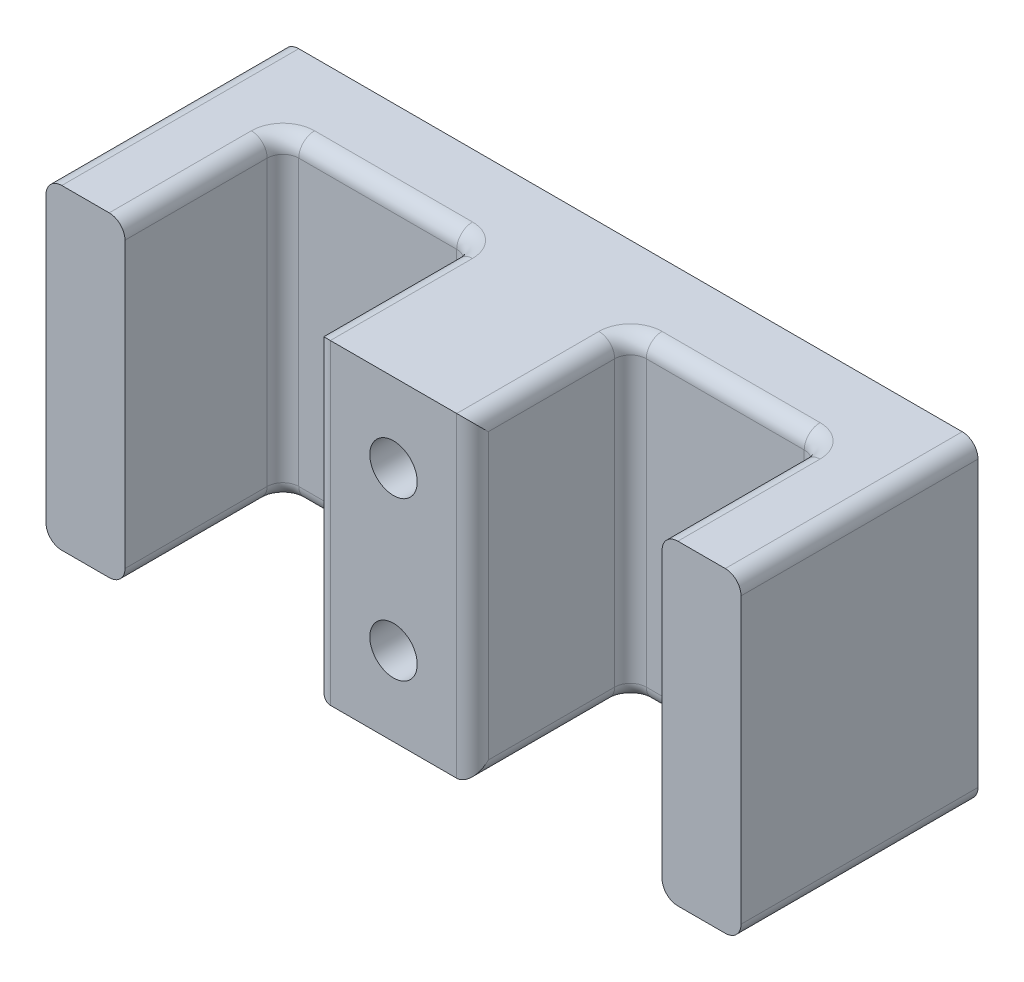
from build123d import *

# Parameters (mm, degrees)
SKETCH1_W           = 44
SKETCH1_H           = 20
BOSS_EXTRUDE1_DEPTH = 5
SKETCH2_W           = 5
SKETCH2_H           = 20
SKETCH2_W_2         = 10
BOSS_EXTRUDE2_DEPTH = 10
CUT_EXTRUDE1_REACH  = 51.356
SKETCH4_R           = 1.75
SKETCH5_R           = 1.5
CUT_EXTRUDE2_DEPTH  = 7
FILLET1_R           = 1


with BuildPart() as part:
    # Sketch1 → Boss-Extrude1 (new body)
    with BuildSketch(Plane.XY):
        with Locations((22, 10)):
            Rectangle(SKETCH1_W, SKETCH1_H)
    extrude(amount=BOSS_EXTRUDE1_DEPTH)

    # Sketch2 → Boss-Extrude2 (add)
    with BuildSketch(Plane.XY.offset(5)):
        with Locations((2.5, 10)):
            Rectangle(SKETCH2_W, SKETCH2_H)
        with Locations((22, 10)):
            Rectangle(SKETCH2_W_2, SKETCH2_H)
        with Locations((41.5, 10)):
            Rectangle(SKETCH2_W, SKETCH2_H)
    extrude(amount=BOSS_EXTRUDE2_DEPTH)

    # Sketch4 → Cut-Extrude1 (cut, up to next)
    with BuildSketch(Plane.XY.offset(5), mode=Mode.PRIVATE) as cut_extrude1_sk1:
        with Locations((11, 10)):
            Circle(SKETCH4_R)
    cut_extrude1_tool1 = extrude(cut_extrude1_sk1.sketch, amount=-CUT_EXTRUDE1_REACH, mode=Mode.PRIVATE) & part.part
    # Sketch4 → Cut-Extrude1 (cut, up to next)
    with BuildSketch(Plane.XY.offset(5), mode=Mode.PRIVATE) as cut_extrude1_sk2:
        with Locations((33, 10)):
            Circle(SKETCH4_R)
    cut_extrude1_tool2 = extrude(cut_extrude1_sk2.sketch, amount=-CUT_EXTRUDE1_REACH, mode=Mode.PRIVATE) & part.part
    add(cut_extrude1_tool1.solids().sort_by_distance((11, 10, 5))[0], mode=Mode.SUBTRACT)
    add(cut_extrude1_tool2.solids().sort_by_distance((33, 10, 5))[0], mode=Mode.SUBTRACT)

    # Sketch5 → Cut-Extrude2 (cut)
    with BuildSketch(Plane.XY.offset(15)):
        with Locations((22, 15)):
            Circle(SKETCH5_R)
        with Locations((22, 5)):
            Circle(SKETCH5_R)
    extrude(amount=-CUT_EXTRUDE2_DEPTH, mode=Mode.SUBTRACT)

    # Fillet1
    fillet1_edges = [part.edges().sort_by_distance(p)[0] for p in [
        (11, 0, 5),
        (5, 10, 5),
        (5, 0, 10),
        (5, 20, 10),
        (33, 0, 5),
        (11, 20, 5),
        (17, 10, 5),
        (17, 20, 10),
        (17, 0, 10),
        (27, 10, 5),
        (27, 0, 10),
        (27, 20, 10),
        (17, 10, 15),
        (27, 10, 15),
        (33, 20, 5),
        (39, 0, 10),
        (39, 10, 5),
        (39, 20, 10),
        (0, 20, 7.5),
        (44, 20, 7.5),
        (44, 0, 7.5),
        (0, 0, 7.5),
    ]]
    fillet(fillet1_edges, radius=FILLET1_R)


solid = part.part
